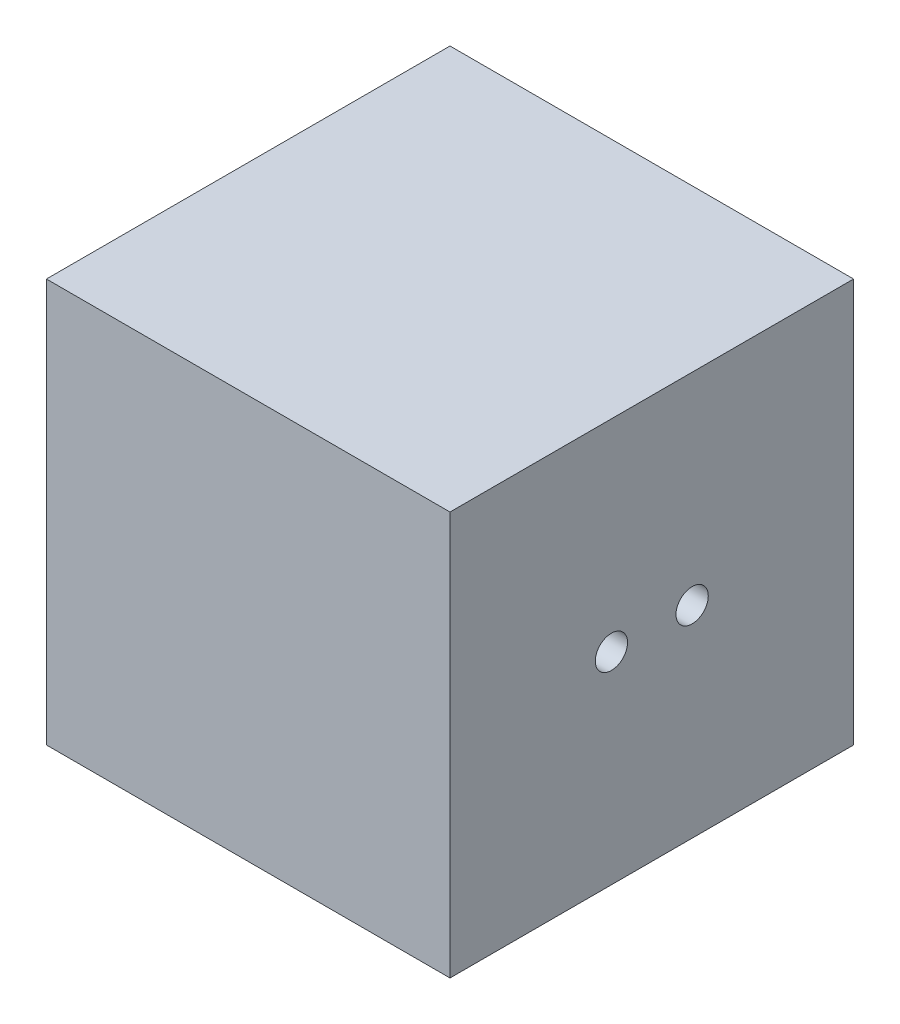
from build123d import *

# Parameters (mm, degrees)
ESBO_O1_W                = 100
ESBO_O1_H                = 100
RESSALTO_EXTRUS_O1_DEPTH = 100
CORTE_EXTRUS_O1_REACH    = 152
ESBO_O2_R                = 4
ESBO_O3_R                = 7
ESBO_O3_R_2              = 1.7
CORTE_EXTRUS_O2_DEPTH    = 10


with BuildPart() as part:
    # Esboço1 → Ressalto-extrusão1 (new body)
    with BuildSketch(Plane.XY):
        Rectangle(ESBO_O1_W, ESBO_O1_H)
    extrude(amount=RESSALTO_EXTRUS_O1_DEPTH)

    # Esboço2 → Corte-extrusão1 (cut, up to next)
    with BuildSketch(Plane(origin=(50, 0, 0), x_dir=(0, 0, -1), z_dir=(1, 0, 0)), mode=Mode.PRIVATE) as corte_extrus_o1_sk1:
        with Locations((-40, 0)):
            Circle(ESBO_O2_R)
    corte_extrus_o1_tool1 = extrude(corte_extrus_o1_sk1.sketch, amount=-CORTE_EXTRUS_O1_REACH, mode=Mode.PRIVATE) & part.part
    # Esboço2 → Corte-extrusão1 (cut, up to next)
    with BuildSketch(Plane(origin=(50, 0, 0), x_dir=(0, 0, -1), z_dir=(1, 0, 0)), mode=Mode.PRIVATE) as corte_extrus_o1_sk2:
        with Locations((-60, 0)):
            Circle(ESBO_O2_R)
    corte_extrus_o1_tool2 = extrude(corte_extrus_o1_sk2.sketch, amount=-CORTE_EXTRUS_O1_REACH, mode=Mode.PRIVATE) & part.part
    add(corte_extrus_o1_tool1.solids().sort_by_distance((50, 0, 40))[0], mode=Mode.SUBTRACT)
    add(corte_extrus_o1_tool2.solids().sort_by_distance((50, 0, 60))[0], mode=Mode.SUBTRACT)

    # Esboço3 → Corte-extrusão2 (cut)
    with BuildSketch(Plane(origin=(0, -50, 0), x_dir=(-1, 0, 0), z_dir=(0, -1, 0))):
        with Locations(Location((0, -50, 0), (0, 0, 180))):
            Circle(ESBO_O3_R)
        with Locations(Location((0, -25, 0), (0, 0, 180))):
            Circle(ESBO_O3_R_2)
        with Locations(Location((21.650635095, -62.5, 0), (0, 0, 180))):
            Circle(ESBO_O3_R_2)
        with Locations(Location((-21.650635095, -62.5, 0), (0, 0, 180))):
            Circle(ESBO_O3_R_2)
    extrude(amount=-CORTE_EXTRUS_O2_DEPTH, mode=Mode.SUBTRACT)


solid = part.part
